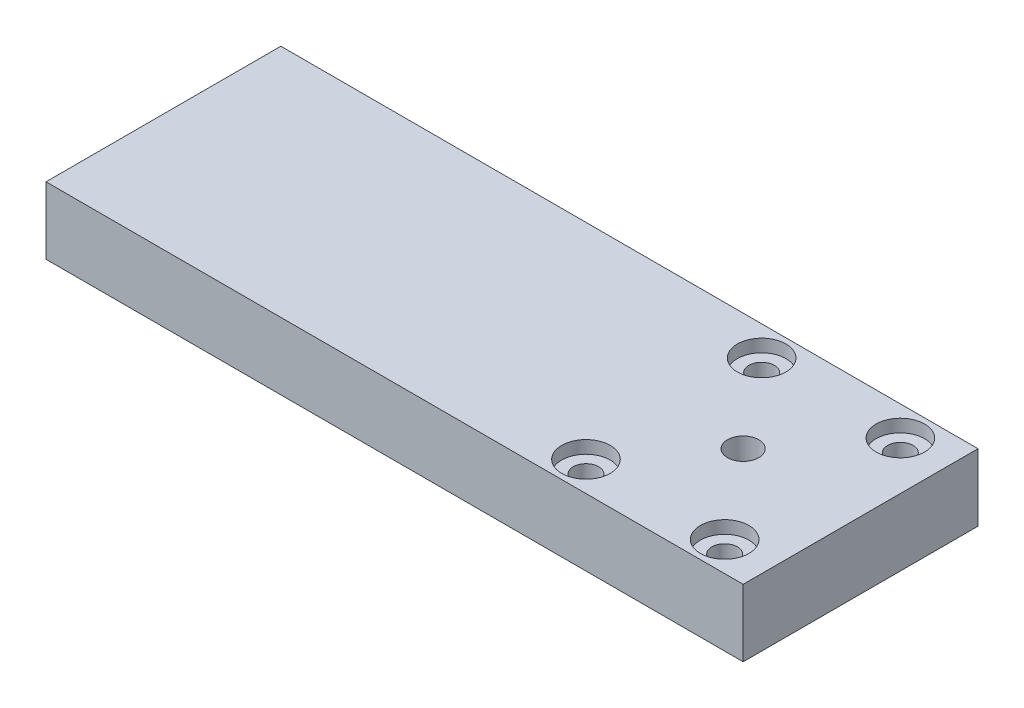
from build123d import *

# Parameters (mm, degrees)
SKETCH1_W                                        = 50.8
SKETCH1_H                                        = 50.8
BOSS_EXTRUDE1_DEPTH                              = 7.26
CBORE_FOR_M5_SBHCS1_D                            = 5.5
CBORE_FOR_M5_SBHCS1_CBORE_D                      = 10.5
CBORE_FOR_M5_SBHCS1_CBORE_DEPTH                  = 2.75
CBORE_FOR_1_4_SOCKET_HEAD_CAP_SCREW1_D           = 6.7564
CBORE_FOR_1_4_SOCKET_HEAD_CAP_SCREW1_CBORE_D     = 11.1125
CBORE_FOR_1_4_SOCKET_HEAD_CAP_SCREW1_CBORE_DEPTH = 6.35
SKETCH6_W                                        = 50.8
SKETCH6_H                                        = 14.52
BOSS_EXTRUDE2_DEPTH                              = 100


with BuildPart() as part:
    # Sketch1 → Boss-Extrude1 (new, symmetric)
    with BuildSketch(Plane(origin=(0, 0, 0), x_dir=(1, 0, 0), z_dir=(0, 1, 0))):
        Rectangle(SKETCH1_W, SKETCH1_H)
    extrude(amount=BOSS_EXTRUDE1_DEPTH, both=True)

    # CBORE for M5 SBHCS1 (through all)
    with Locations(Plane(origin=(0, 7.26, 0), x_dir=(1, 0, 0), z_dir=(0, 1, 0))):
        with Locations((-15, 19), (-15, -19), (15, -19), (15, 19)):
            CounterBoreHole(CBORE_FOR_M5_SBHCS1_D / 2, CBORE_FOR_M5_SBHCS1_CBORE_D / 2, CBORE_FOR_M5_SBHCS1_CBORE_DEPTH)

    # CBORE for 1/4 Socket Head Cap Screw1 (through all)
    with Locations(Plane.XZ.offset(7.26)):
        with Locations((0, 0)):
            CounterBoreHole(CBORE_FOR_1_4_SOCKET_HEAD_CAP_SCREW1_D / 2, CBORE_FOR_1_4_SOCKET_HEAD_CAP_SCREW1_CBORE_D / 2, CBORE_FOR_1_4_SOCKET_HEAD_CAP_SCREW1_CBORE_DEPTH)

    # Sketch6 → Boss-Extrude2 (add)
    with BuildSketch(Plane.ZY.offset(25.4)):
        Rectangle(SKETCH6_W, SKETCH6_H)
    extrude(amount=BOSS_EXTRUDE2_DEPTH)


solid = part.part
